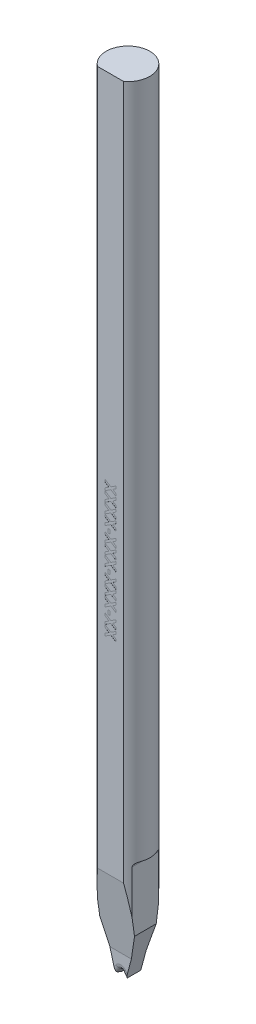
from build123d import *

# Parameters (mm, degrees)
SKETCH_TL_CUTTING_R       = 1.99771
TL_CUTTING_DEPTH          = 72.009
SKETCH_TDF_GRINDING_W     = 4.01542
SKETCH_TDF_GRINDING_H     = 4.01542
TDF_GRINDING_DEPTH        = 73.064400167
SKETCH_ENGRAVING_W        = 0.166666667
SKETCH_ENGRAVING_H        = 0.371794872
ENGRAVING_DEPTH           = 0.005
VW_VR_GRINDING_DEPTH      = 2.00771
VW_VR_GRINDING_DEPTH_BACK = 2.00771
ISA_GRINDING_DEPTH        = 2.00771
ISA_GRINDING_DEPTH_BACK   = 2.00771
PRE_FRX_BRX_DEPTH         = 2.00771
PRE_FRX_BRX_DEPTH_BACK    = 2.00771
SKETCH_PRE_FRX_BRX_W      = 1.33334
SKETCH_PRE_FRX_BRX_H      = 1.80086
FR_EDM_R                  = 0.50038
BR_EDM_R                  = 0.24892
FA_BA_GRINDING_DEPTH      = 2.00771
FA_BA_GRINDING_DEPTH_BACK = 2.00771


with BuildPart() as part:
    # sketch_TL_cutting → TL_cutting (new body)
    with BuildSketch(Plane(origin=(0, 0, 0), x_dir=(1, 0, 0), z_dir=(0, 1, 0))):
        Circle(SKETCH_TL_CUTTING_R)
    extrude(amount=TL_CUTTING_DEPTH)

    # sketch_TDF_grinding → TDF_grinding (cut, through all)
    with BuildSketch(Plane(origin=(0, 0, 0), x_dir=(1, 0, 0), z_dir=(0, 1, 0))):
        with Locations((0, -3.60918)):
            Rectangle(SKETCH_TDF_GRINDING_W, SKETCH_TDF_GRINDING_H)
    extrude(amount=TDF_GRINDING_DEPTH, mode=Mode.SUBTRACT)

    # sketch_engraving → engraving (cut)
    with BuildSketch(Plane.XY.offset(1.60147)):
        Polygon((-0.5, 39.598539744), (0.029647436, 39.255791346), (0.5, 39.560078205), (0.5, 39.33531859), (0.203325321, 39.143411538), (0.5, 38.951504487), (0.5, 38.726744872), (0.029647436, 39.031031731), (-0.5, 38.688283333), (-0.5, 38.913042949), (-0.144030449, 39.143411538), (-0.5, 39.373780128), align=None)
        Polygon((-0.5, 38.675462821), (0.029647436, 38.332714423), (0.5, 38.637001282), (0.5, 38.412241667), (0.203325321, 38.220334615), (0.5, 38.028427564), (0.5, 37.803667949), (0.029647436, 38.107954808), (-0.5, 37.76520641), (-0.5, 37.989966026), (-0.144030449, 38.220334615), (-0.5, 38.450703205), align=None)
        Polygon((-0.5, 37.752385897), (0.029647436, 37.4096375), (0.5, 37.713924359), (0.5, 37.489164744), (0.203325321, 37.297257692), (0.5, 37.105350641), (0.5, 36.880591026), (0.029647436, 37.184877885), (-0.5, 36.842129487), (-0.5, 37.066889103), (-0.144030449, 37.297257692), (-0.5, 37.527626282), align=None)
        Polygon((-0.5, 36.829308974), (0.029647436, 36.486560577), (0.5, 36.790847436), (0.5, 36.566087821), (0.203325321, 36.374180769), (0.5, 36.182273718), (0.5, 35.957514103), (0.029647436, 36.261800962), (-0.5, 35.919052564), (-0.5, 36.143812179), (-0.144030449, 36.374180769), (-0.5, 36.604549359), align=None)
        with Locations((-0.147435898, 35.649821795)):
            Rectangle(SKETCH_ENGRAVING_W, SKETCH_ENGRAVING_H)
        Polygon((-0.5, 35.44469359), (0.029647436, 35.101945192), (0.5, 35.406232051), (0.5, 35.181472436), (0.203325321, 34.989565385), (0.5, 34.797658333), (0.5, 34.572898718), (0.029647436, 34.877185577), (-0.5, 34.534437179), (-0.5, 34.759196795), (-0.144030449, 34.989565385), (-0.5, 35.219933974), align=None)
        Polygon((-0.5, 34.521616667), (0.029647436, 34.178868269), (0.5, 34.483155128), (0.5, 34.258395513), (0.203325321, 34.066488462), (0.5, 33.87458141), (0.5, 33.649821795), (0.029647436, 33.954108654), (-0.5, 33.611360256), (-0.5, 33.836119872), (-0.144030449, 34.066488462), (-0.5, 34.296857051), align=None)
        Polygon((-0.5, 33.598539744), (0.029647436, 33.255791346), (0.5, 33.560078205), (0.5, 33.33531859), (0.203325321, 33.143411538), (0.5, 32.951504487), (0.5, 32.726744872), (0.029647436, 33.031031731), (-0.5, 32.688283333), (-0.5, 32.913042949), (-0.144030449, 33.143411538), (-0.5, 33.373780128), align=None)
        with Locations((-0.147435898, 32.419052564)):
            Rectangle(SKETCH_ENGRAVING_W, SKETCH_ENGRAVING_H)
        Polygon((-0.5, 32.213924359), (0.029647436, 31.871175962), (0.5, 32.175462821), (0.5, 31.950703205), (0.203325321, 31.758796154), (0.5, 31.566889103), (0.5, 31.342129487), (0.029647436, 31.646416346), (-0.5, 31.303667949), (-0.5, 31.528427564), (-0.144030449, 31.758796154), (-0.5, 31.989164744), align=None)
        Polygon((-0.5, 31.290847436), (0.029647436, 30.948099038), (0.5, 31.252385897), (0.5, 31.027626282), (0.203325321, 30.835719231), (0.5, 30.643812179), (0.5, 30.419052564), (0.029647436, 30.723339423), (-0.5, 30.380591026), (-0.5, 30.605350641), (-0.144030449, 30.835719231), (-0.5, 31.066087821), align=None)
        Polygon((-0.5, 30.367770513), (0.029647436, 30.025022115), (0.5, 30.329308974), (0.5, 30.104549359), (0.203325321, 29.912642308), (0.5, 29.720735256), (0.5, 29.495975641), (0.029647436, 29.8002625), (-0.5, 29.457514103), (-0.5, 29.682273718), (-0.144030449, 29.912642308), (-0.5, 30.143010897), align=None)
        with Locations((-0.147435898, 29.188283333)):
            Rectangle(SKETCH_ENGRAVING_W, SKETCH_ENGRAVING_H)
        Polygon((-0.5, 28.983155128), (0.029647436, 28.640406731), (0.5, 28.94469359), (0.5, 28.719933974), (0.203325321, 28.528026923), (0.5, 28.336119872), (0.5, 28.111360256), (0.029647436, 28.415647115), (-0.5, 28.072898718), (-0.5, 28.297658333), (-0.144030449, 28.528026923), (-0.5, 28.758395513), align=None)
        Polygon((-0.5, 28.060078205), (0.029647436, 27.717329808), (0.5, 28.021616667), (0.5, 27.796857051), (0.203325321, 27.60495), (0.5, 27.413042949), (0.5, 27.188283333), (0.029647436, 27.492570192), (-0.5, 27.149821795), (-0.5, 27.37458141), (-0.144030449, 27.60495), (-0.5, 27.83531859), align=None)
    extrude(amount=-ENGRAVING_DEPTH, mode=Mode.SUBTRACT)

    # sketch_VW_VR_grinding → VW_VR_grinding (cut, two sides: drawn at the far end of the back side and taken through both)
    with BuildSketch(Plane.XY.offset(-VW_VR_GRINDING_DEPTH_BACK)):
        with BuildLine():
            Line((-1.59004, -0.01), (-1.59004, 9.681972))
            ThreePointArc((-1.59004, 9.681972), (-1.683182387, 9.906837613), (-1.908048, 9.99998))
            Line((-1.908048, 9.99998), (-2.00771, 9.99998))
            Line((-2.00771, 9.99998), (-2.00771, -0.01))
            Line((-2.00771, -0.01), (-1.59004, -0.01))
        make_face()
        with BuildLine():
            Line((1.59004, -0.01), (1.59004, 9.681972))
            ThreePointArc((1.59004, 9.681972), (1.683182387, 9.906837613), (1.908048, 9.99998))
            Line((1.908048, 9.99998), (2.00771, 9.99998))
            Line((2.00771, 9.99998), (2.00771, -0.01))
            Line((2.00771, -0.01), (1.59004, -0.01))
        make_face()
    extrude(amount=VW_VR_GRINDING_DEPTH + VW_VR_GRINDING_DEPTH_BACK, mode=Mode.SUBTRACT)

    # sketch_ISA_grinding → ISA_grinding (cut, two sides: drawn at the far end of the back side and taken through both)
    with BuildSketch(Plane.XY.offset(-ISA_GRINDING_DEPTH_BACK)):
        Polygon((-0.50038, 0), (-2.00771, 5.625432144), (-2.00771, -0.01), (2.00771, -0.01), (2.00771, 5.625432144), (0.50038, 0), align=None)
    extrude(amount=ISA_GRINDING_DEPTH + ISA_GRINDING_DEPTH_BACK, mode=Mode.SUBTRACT)

    # sketch_pre_FRX_BRX → pre_FRX_BRX (cut, two sides: drawn at the far end of the back side and taken through both)
    with BuildSketch(Plane(origin=(0, 0, 0), x_dir=(0, 0, -1), z_dir=(1, 0, 0)).offset(-PRE_FRX_BRX_DEPTH_BACK)):
        with Locations((-1.34104, 0.89043)):
            Rectangle(SKETCH_PRE_FRX_BRX_W, SKETCH_PRE_FRX_BRX_H)
        with Locations((1.34104, 0.89043)):
            Rectangle(SKETCH_PRE_FRX_BRX_W, SKETCH_PRE_FRX_BRX_H)
    extrude(amount=PRE_FRX_BRX_DEPTH + PRE_FRX_BRX_DEPTH_BACK, mode=Mode.SUBTRACT)

    # V-Groove_EDM: sweep along a path in sketch_contour_V-Groove
    with BuildLine(Plane(origin=(0, 0, 0), x_dir=(0, 0, -1), z_dir=(1, 0, 0))) as v_groove_edm_path:
        Line((-1.60147, 0.3556), (0, 0.3556))
        Line((0, 0.3556), (1.99771, 0.3556))
    # sketch_section_V-Groove → V-Groove_EDM (sweep, cut)
    with BuildSketch(Plane.XY.offset(1.60147)):
        with BuildLine():
            Line((-2.765528006, -3.556), (-0.041851153, 0.333813669))
            ThreePointArc((-0.041851153, 0.333813669), (0, 0.3556), (0.041851153, 0.333813669))
            Line((0.041851153, 0.333813669), (2.765528006, -3.556))
            Line((2.765528006, -3.556), (-2.765528006, -3.556))
        make_face()
    sweep(path=v_groove_edm_path.line, mode=Mode.SUBTRACT)

    # FR_EDM
    fr_edm_edges = [part.edges().sort_by_distance(p)[0] for p in [
        (0.158720576, 0.166906834, 0.67437),
        (0, 0.3556, 0.67437),
        (-0.158720576, 0.166906834, 0.67437),
    ]]
    fillet(fr_edm_edges, radius=FR_EDM_R)

    # BR_EDM
    br_edm_edges = [part.edges().sort_by_distance(p)[0] for p in [
        (0.158720576, 0.166906834, -0.67437),
        (0, 0.3556, -0.67437),
        (-0.158720576, 0.166906834, -0.67437),
    ]]
    fillet(br_edm_edges, radius=BR_EDM_R)

    # sketch_FA_BA_grinding → FA_BA_grinding (cut, two sides: drawn at the far end of the back side and taken through both)
    with BuildSketch(Plane(origin=(0, 0, 0), x_dir=(0, 0, -1), z_dir=(1, 0, 0)).offset(-FA_BA_GRINDING_DEPTH_BACK)):
        Polygon((2.99771, 18.332283091), (2.99771, -0.1), (0.67437, -0.1), (0.67437, 1.80086), align=None)
        Polygon((-3.622078656, 22.774896919), (-0.67437, 1.80086), (-0.67437, -0.1), (-3.622078656, -0.1), align=None)
    extrude(amount=FA_BA_GRINDING_DEPTH + FA_BA_GRINDING_DEPTH_BACK, mode=Mode.SUBTRACT)


solid = part.part
